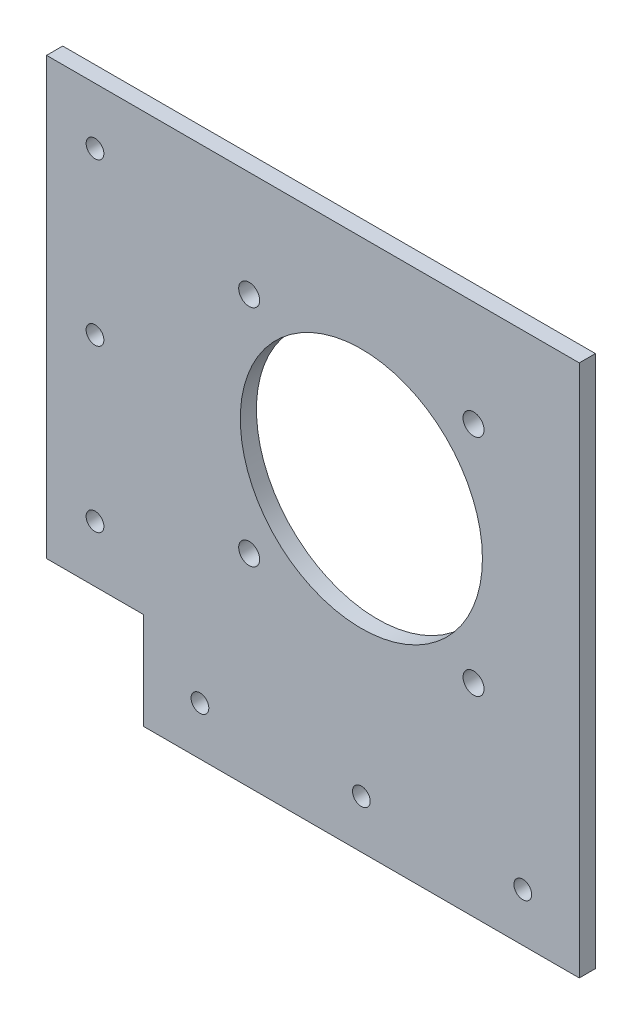
from build123d import *

# Parameters (mm, degrees)
SKETCH_1_R      = 37.5
SKETCH_1_R_2    = 3.25
SKETCH_1_R_3    = 2.75
EXTRUDE_1_DEPTH = 5


with BuildPart() as part:
    # 草图1 → 凸台-拉伸1 (new body)
    with BuildSketch(Plane.XY):
        Polygon((0, 0), (-135, 0), (-135, 30), (-165, 30), (-165, 165), (0, 165), align=None)
        with Locations((-67.5, 97.5)):
            Circle(SKETCH_1_R, mode=Mode.SUBTRACT)
        with Locations((-102.25, 132.25)):
            Circle(SKETCH_1_R_2, mode=Mode.SUBTRACT)
        with Locations((-32.75, 132.25)):
            Circle(SKETCH_1_R_2, mode=Mode.SUBTRACT)
        with Locations((-32.75, 62.75)):
            Circle(SKETCH_1_R_2, mode=Mode.SUBTRACT)
        with Locations((-102.25, 62.75)):
            Circle(SKETCH_1_R_2, mode=Mode.SUBTRACT)
        with Locations((-150, 147.5)):
            Circle(SKETCH_1_R_3, mode=Mode.SUBTRACT)
        with Locations((-150, 97.5)):
            Circle(SKETCH_1_R_3, mode=Mode.SUBTRACT)
        with Locations((-67.5, 15)):
            Circle(SKETCH_1_R_3, mode=Mode.SUBTRACT)
        with Locations((-17.5, 15)):
            Circle(SKETCH_1_R_3, mode=Mode.SUBTRACT)
        with Locations((-117.5, 15)):
            Circle(SKETCH_1_R_3, mode=Mode.SUBTRACT)
        with Locations((-150, 47.5)):
            Circle(SKETCH_1_R_3, mode=Mode.SUBTRACT)
    extrude(amount=EXTRUDE_1_DEPTH)


solid = part.part
